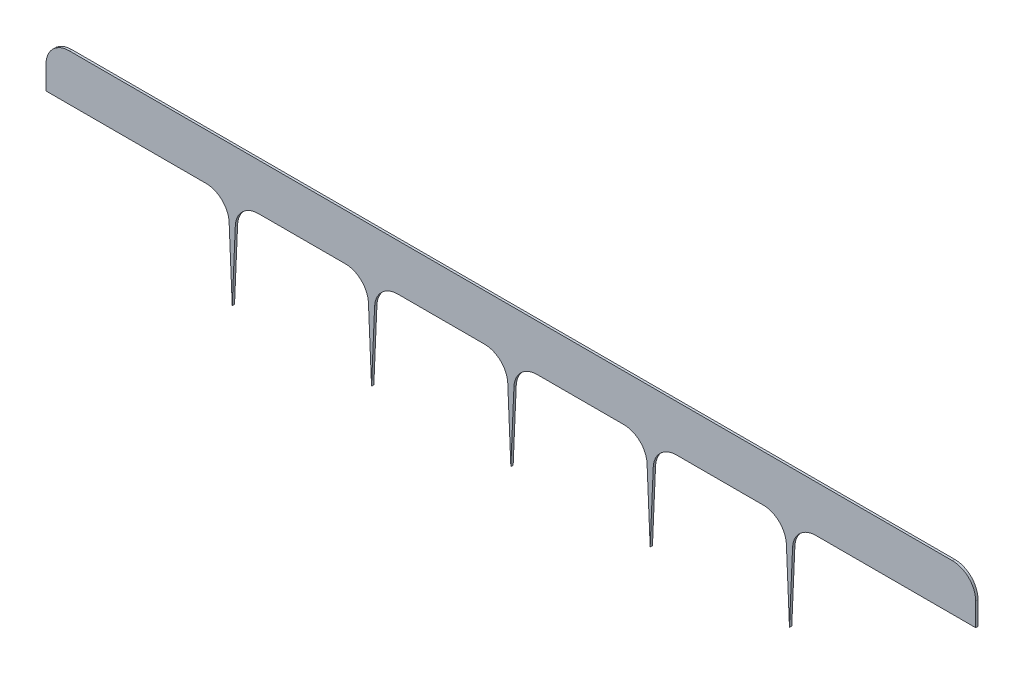
from build123d import *

# Parameters (mm, degrees)
BOSS_EXTRUDE1_DEPTH = 0.025


with BuildPart() as part:
    # Model → Boss-Extrude1 (new body)
    with BuildSketch(Plane.XY):
        with BuildLine():
            Line((8.5975, 1.5), (1.9475, 1.5))
            Line((1.9475, 1.5), (0.526264761, 1.5))
            ThreePointArc((0.526264761, 1.5), (0.349488066, 1.426776695), (0.276264761, 1.25))
            Line((0.276264761, 1.25), (0.276264761, 1))
            Line((0.276264761, 1), (0.706264761, 1))
            Line((0.706264761, 1), (1.248280883, 1))
            Line((1.248280883, 1), (1.998280883, 1))
            ThreePointArc((1.998280883, 1), (2.171159147, 0.930590991), (2.248042938, 0.760904847))
            Line((2.248042938, 0.760904847), (2.281264761, 0))
            Line((2.281264761, 0), (2.314486584, 0.760904847))
            ThreePointArc((2.314486584, 0.760904847), (2.391370376, 0.930590991), (2.56424864, 1))
            Line((2.56424864, 1), (3.498280883, 1))
            ThreePointArc((3.498280883, 1), (3.671159147, 0.930590991), (3.748042938, 0.760904847))
            Line((3.748042938, 0.760904847), (3.781264761, 0))
            Line((3.781264761, 0), (3.814486584, 0.760904847))
            ThreePointArc((3.814486584, 0.760904847), (3.891370376, 0.930590991), (4.06424864, 1))
            Line((4.06424864, 1), (4.998280883, 1))
            ThreePointArc((4.998280883, 1), (5.171159147, 0.930590991), (5.248042938, 0.760904847))
            Line((5.248042938, 0.760904847), (5.281264761, 0))
            Line((5.281264761, 0), (5.314486584, 0.760904847))
            ThreePointArc((5.314486584, 0.760904847), (5.391370376, 0.930590991), (5.56424864, 1))
            Line((5.56424864, 1), (6.498280883, 1))
            ThreePointArc((6.498280883, 1), (6.671159147, 0.930590991), (6.748042938, 0.760904847))
            Line((6.748042938, 0.760904847), (6.781264761, 0))
            Line((6.781264761, 0), (6.814486584, 0.760904847))
            ThreePointArc((6.814486584, 0.760904847), (6.891370376, 0.930590991), (7.06424864, 1))
            Line((7.06424864, 1), (7.998280883, 1))
            ThreePointArc((7.998280883, 1), (8.171159147, 0.930590991), (8.248042938, 0.760904847))
            Line((8.248042938, 0.760904847), (8.281264761, 0))
            Line((8.281264761, 0), (8.314486584, 0.760904847))
            ThreePointArc((8.314486584, 0.760904847), (8.391370376, 0.930590991), (8.56424864, 1))
            Line((8.56424864, 1), (9.31424864, 1))
            Line((9.31424864, 1), (9.856264761, 1))
            Line((9.856264761, 1), (10.286264761, 1))
            Line((10.286264761, 1), (10.286264761, 1.25))
            ThreePointArc((10.286264761, 1.25), (10.213041457, 1.426776695), (10.036264761, 1.5))
            Line((10.036264761, 1.5), (8.5975, 1.5))
        make_face()
    extrude(amount=BOSS_EXTRUDE1_DEPTH)


solid = part.part
